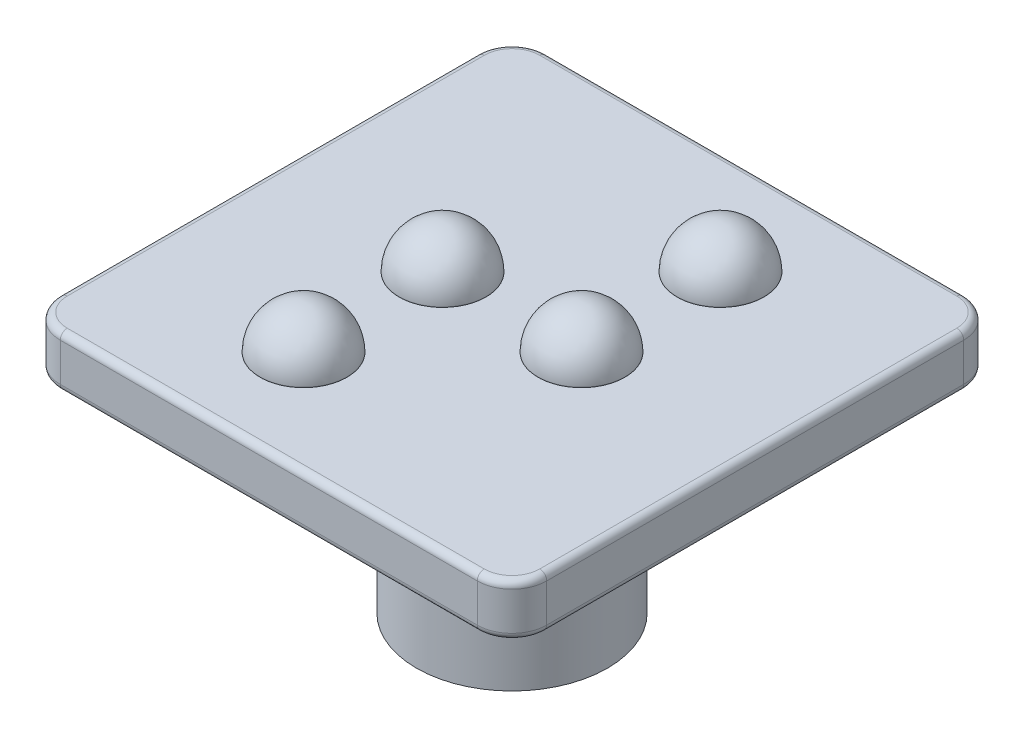
from build123d import *

# Parameters (mm, degrees)
BOSS_EXTRUDE1_DEPTH = 1.5
SKETCH2_R           = 2.75
BOSS_EXTRUDE2_DEPTH = 6
SKETCH3_W           = 1.1
SKETCH3_H           = 1.45
SKETCH3_W_2         = 1.45
SKETCH3_H_2         = 1.1
CUT_EXTRUDE1_DEPTH  = 6
CHAMFER1_SIZE       = 0.3
FILLET1_R           = 1
SKETCH4_R           = 1.25
BOSS_EXTRUDE3_DEPTH = 0.01
DOME2_FACE_RADIUS   = 1.25
DOME2_HEIGHT        = 1.25
DOME3_FACE_RADIUS   = 1.25
DOME3_HEIGHT        = 1.25
DOME4_FACE_RADIUS   = 1.25
DOME4_HEIGHT        = 1.25
DOME5_FACE_RADIUS   = 1.25
DOME5_HEIGHT        = 1.25
FILLET3_R           = 0.2


with BuildPart() as part:
    # Sketch1 → Boss-Extrude1 (new body)
    with BuildSketch(Plane(origin=(0, 0, 0), x_dir=(1, 0, 0), z_dir=(0, 1, 0))):
        with BuildLine():
            Line((-7.324675649, 4.396717546), (4.675324351, 4.396717546))
            ThreePointArc((4.675324351, 4.396717546), (5.382431132, 4.103824327), (5.675324351, 3.396717546))
            Line((5.675324351, 3.396717546), (5.675324351, -8.603282454))
            ThreePointArc((5.675324351, -8.603282454), (5.382431132, -9.310389235), (4.675324351, -9.603282454))
            Line((4.675324351, -9.603282454), (-7.324675649, -9.603282454))
            ThreePointArc((-7.324675649, -9.603282454), (-8.03178243, -9.310389235), (-8.324675649, -8.603282454))
            Line((-8.324675649, -8.603282454), (-8.324675649, 3.396717546))
            ThreePointArc((-8.324675649, 3.396717546), (-8.03178243, 4.103824327), (-7.324675649, 4.396717546))
        make_face()
    extrude(amount=BOSS_EXTRUDE1_DEPTH)

    # Sketch2 → Boss-Extrude2 (add)
    with BuildSketch(Plane.XZ):
        with Locations(Location((-1.324675649, 2.603282454, 0), (0, 0, 270))):
            Circle(SKETCH2_R)
    extrude(amount=BOSS_EXTRUDE2_DEPTH)

    # Sketch3 → Cut-Extrude1 (cut)
    with BuildSketch(Plane.XZ.offset(6)):
        with Locations((-1.324675649, 3.878282454)):
            Rectangle(SKETCH3_W, SKETCH3_H)
        with Locations((-0.049675649, 2.603282454)):
            Rectangle(SKETCH3_W_2, SKETCH3_H_2)
        with Locations((-1.324675649, 2.603282454)):
            Rectangle(SKETCH3_W, SKETCH3_H_2)
        with Locations((-2.599675649, 2.603282454)):
            Rectangle(SKETCH3_W_2, SKETCH3_H_2)
        with Locations((-1.324675649, 1.328282454)):
            Rectangle(SKETCH3_W, SKETCH3_H)
    extrude(amount=-CUT_EXTRUDE1_DEPTH, mode=Mode.SUBTRACT)

    # Chamfer1
    chamfer1_edges = [part.edges().sort_by_distance(p)[0] for p in [
        (-0.774675649, -6, 3.878282454),
        (-0.049675649, -6, 3.153282454),
        (0.675324351, -6, 2.603282454),
        (-0.774675649, -6, 1.328282454),
        (-2.599675649, -6, 3.153282454),
        (-1.324675649, -6, 4.603282454),
        (-1.874675649, -6, 3.878282454),
        (-3.324675649, -6, 2.603282454),
        (-2.599675649, -6, 2.053282454),
        (-1.874675649, -6, 1.328282454),
        (-1.324675649, -6, 0.603282454),
        (-0.049675649, -6, 2.053282454),
    ]]
    chamfer(chamfer1_edges, length=CHAMFER1_SIZE)

    # Fillet1
    fillet1_edges = [part.edges().sort_by_distance(p)[0] for p in [
        (-1.324675649, 0, 5.353282454),
    ]]
    fillet(fillet1_edges, radius=FILLET1_R)

    # Sketch4 → Boss-Extrude3 (add)
    with BuildSketch(Plane(origin=(0, 1.5, 0), x_dir=(1, 0, 0), z_dir=(0, 1, 0))):
        with Locations(Location((0.675324351, -2.603282454, 0), (0, 0, 90))):
            Circle(SKETCH4_R)
        with Locations(Location((-3.324675649, -2.603282454, 0), (0, 0, 90))):
            Circle(SKETCH4_R)
        with Locations(Location((-3.324675649, -6.603282454, 0), (0, 0, 90))):
            Circle(SKETCH4_R)
        with Locations(Location((0.675324351, 1.396717546, 0), (0, 0, 90))):
            Circle(SKETCH4_R)
    extrude(amount=BOSS_EXTRUDE3_DEPTH)

    # Dome2: a dome of height H over a round flat face of radius A is a cap of a sphere of radius (A * A + H * H) / (2 * H)
    dome2_r = (DOME2_FACE_RADIUS * DOME2_FACE_RADIUS + DOME2_HEIGHT * DOME2_HEIGHT) / (2 * DOME2_HEIGHT)
    dome2_base = Plane((0.675324351, 1.51, -1.396717546), z_dir=(0, 1, 0))
    with Locations(dome2_base.offset(DOME2_HEIGHT - dome2_r)):
        dome2_ball = Sphere(dome2_r, mode=Mode.PRIVATE)
    add(split(dome2_ball, bisect_by=dome2_base, keep=Keep.TOP, mode=Mode.PRIVATE))

    # Dome3: a dome of height H over a round flat face of radius A is a cap of a sphere of radius (A * A + H * H) / (2 * H)
    dome3_r = (DOME3_FACE_RADIUS * DOME3_FACE_RADIUS + DOME3_HEIGHT * DOME3_HEIGHT) / (2 * DOME3_HEIGHT)
    dome3_base = Plane((-3.324675649, 1.51, 2.603282454), z_dir=(0, 1, 0))
    with Locations(dome3_base.offset(DOME3_HEIGHT - dome3_r)):
        dome3_ball = Sphere(dome3_r, mode=Mode.PRIVATE)
    add(split(dome3_ball, bisect_by=dome3_base, keep=Keep.TOP, mode=Mode.PRIVATE))

    # Dome4: a dome of height H over a round flat face of radius A is a cap of a sphere of radius (A * A + H * H) / (2 * H)
    dome4_r = (DOME4_FACE_RADIUS * DOME4_FACE_RADIUS + DOME4_HEIGHT * DOME4_HEIGHT) / (2 * DOME4_HEIGHT)
    dome4_base = Plane((0.675324351, 1.51, 2.603282454), z_dir=(0, 1, 0))
    with Locations(dome4_base.offset(DOME4_HEIGHT - dome4_r)):
        dome4_ball = Sphere(dome4_r, mode=Mode.PRIVATE)
    add(split(dome4_ball, bisect_by=dome4_base, keep=Keep.TOP, mode=Mode.PRIVATE))

    # Dome5: a dome of height H over a round flat face of radius A is a cap of a sphere of radius (A * A + H * H) / (2 * H)
    dome5_r = (DOME5_FACE_RADIUS * DOME5_FACE_RADIUS + DOME5_HEIGHT * DOME5_HEIGHT) / (2 * DOME5_HEIGHT)
    dome5_base = Plane((-3.324675649, 1.51, 6.603282454), z_dir=(0, 1, 0))
    with Locations(dome5_base.offset(DOME5_HEIGHT - dome5_r)):
        dome5_ball = Sphere(dome5_r, mode=Mode.PRIVATE)
    add(split(dome5_ball, bisect_by=dome5_base, keep=Keep.TOP, mode=Mode.PRIVATE))

    # Fillet3
    fillet3_edges = [part.edges().sort_by_distance(p)[0] for p in [
        (5.382431132, 1.5, 9.310389235),
        (-1.324675649, 0, 9.603282454),
        (-8.03178243, 0, 9.310389235),
        (5.675324351, 1.5, 2.603282454),
        (5.382431132, 1.5, -4.103824327),
        (-1.324675649, 1.5, -4.396717546),
        (-8.03178243, 1.5, -4.103824327),
        (-8.324675649, 1.5, 2.603282454),
        (-8.03178243, 1.5, 9.310389235),
        (-1.324675649, 1.5, 9.603282454),
        (-8.324675649, 0, 2.603282454),
        (-8.03178243, 0, -4.103824327),
        (-1.324675649, 0, -4.396717546),
        (5.382431132, 0, -4.103824327),
        (5.675324351, 0, 2.603282454),
        (5.382431132, 0, 9.310389235),
    ]]
    fillet(fillet3_edges, radius=FILLET3_R)


solid = part.part
